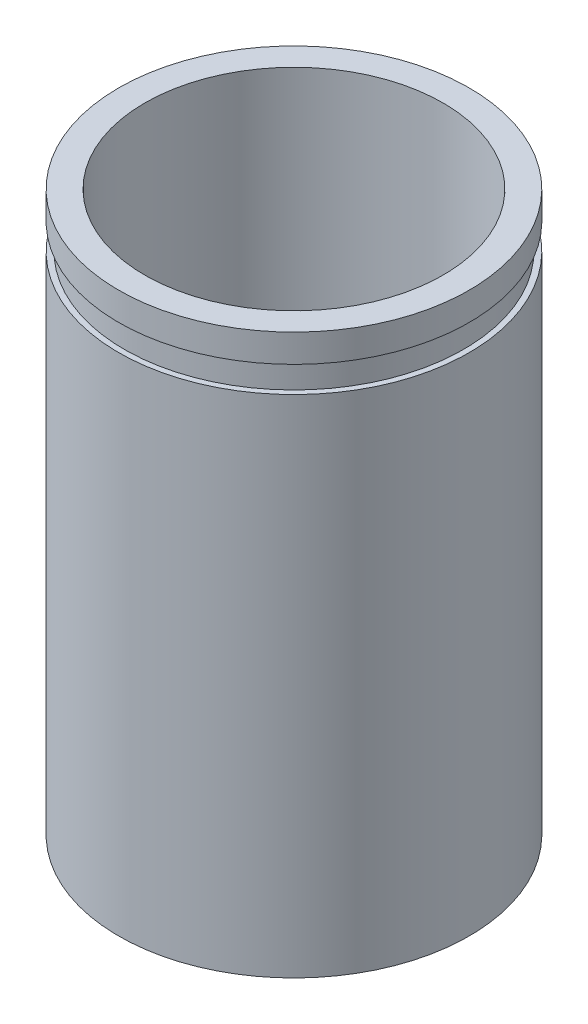
from build123d import *


with BuildPart() as part:
    # Sketch1 → Revolve1 (revolve)
    with BuildSketch(Plane.XY, mode=Mode.PRIVATE) as revolve1_sk:
        Polygon((17.272787185, -15.787634183), (17.272787185, 134.212365817), (24.272787185, 134.212365817), (24.272787185, 126.712365817), (22.772787185, 126.712365817), (22.772787185, 119.712365817), (24.272787185, 119.712365817), (24.272787185, -15.787634183), align=None)
    revolve(revolve1_sk.sketch.rotate(Axis((-22.727212815, 134.212365817, 0), (0, -1, 0)), 180), axis=Axis((-22.727212815, 134.212365817, 0), (0, -1, 0)))


solid = part.part
